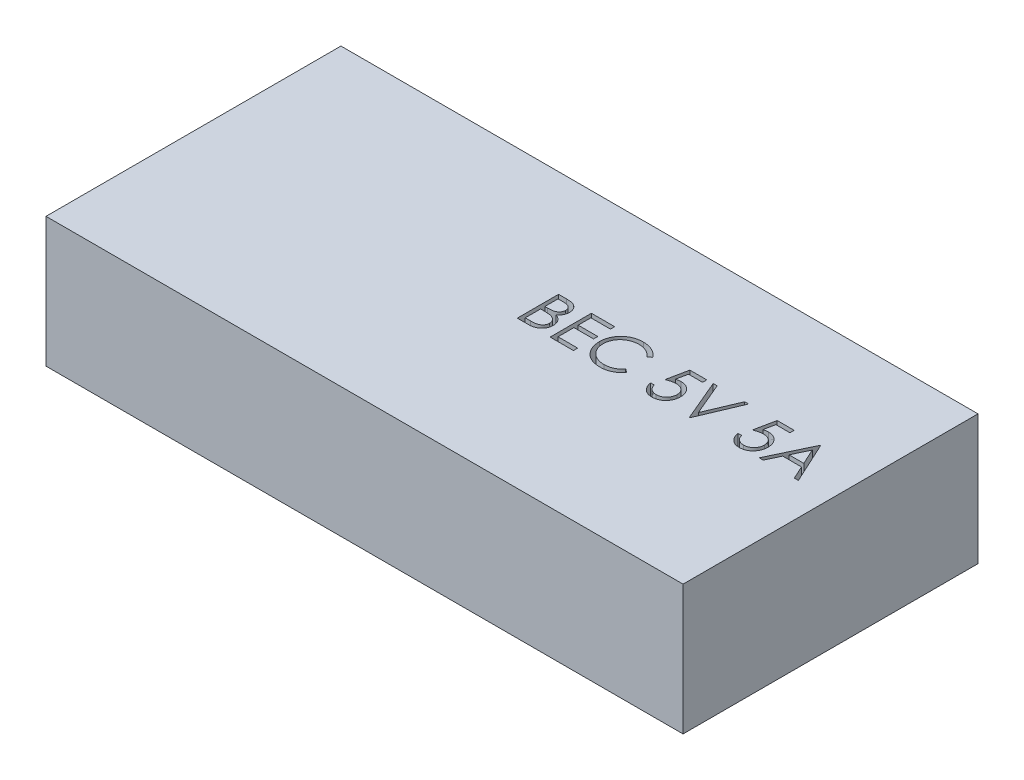
from build123d import *

# Parameters (mm, degrees)
SCHIZZO1_W                   = 54
SCHIZZO1_H                   = 25
ESTRUSIONE_ESTRUSIONE1_DEPTH = 11
TAGLIO_ESTRUSIONE1_DEPTH     = 2


with BuildPart() as part:
    # Schizzo1 → Estrusione-Estrusione1 (new body)
    with BuildSketch(Plane(origin=(0, 0, 0), x_dir=(1, 0, 0), z_dir=(0, 1, 0))):
        Rectangle(SCHIZZO1_W, SCHIZZO1_H)
    extrude(amount=ESTRUSIONE_ESTRUSIONE1_DEPTH)

    # Schizzo2 → Taglio-Estrusione1 (cut)
    # profile 1 of 7: a face of its own
    with BuildSketch(Plane(origin=(0, 11, 0), x_dir=(1, 0, 0), z_dir=(0, 1, 0))):
        with BuildLine():
            Line((0.448717949, 3.5), (1.131610577, 3.5))
            add(Edge.make_bspline(
                [(1.131610577, 3.5), (1.165039055, 3.49982425), (1.229831765, 3.499483602), (1.324051207, 3.49420047), (1.412300018, 3.486996801), (1.49460379, 3.475566708), (1.570924493, 3.461774931), (1.64149213, 3.445073115), (1.706082302, 3.425046501), (1.783195039, 3.39320022), (1.871115699, 3.345877051), (1.966314092, 3.275948486), (2.047718332, 3.190416023), (2.117904649, 3.093933368), (2.173705768, 2.987797596), (2.214075066, 2.874538407), (2.239632941, 2.755616665), (2.242261375, 2.673973487), (2.243589744, 2.63271234)],
                knots=[0, 0, 0, 0, 1.001505555, 1.941167018, 2.826882275, 3.653841531, 4.429895133, 5.150066043, 5.825578002, 6.45369114, 7.647487171, 8.808567382, 9.977351308, 11.170798116, 12.373658725, 13.556498008, 14.765093433, 16, 16, 16, 16], degree=3))
            add(Edge.make_bspline(
                [(2.243589744, 2.63271234), (2.242496525, 2.594059784), (2.240348248, 2.518103867), (2.219805488, 2.407009758), (2.18764482, 2.301258539), (2.142939571, 2.201236154), (2.084837575, 2.10920254), (2.015979256, 2.024415274), (1.932902454, 1.950464217), (1.870659214, 1.909121315), (1.839042468, 1.888120994)],
                knots=[0, 0, 0, 0, 1.044552857, 2.05264487, 3.044412934, 4.028983338, 5.005914585, 5.980388656, 6.974128949, 8, 8, 8, 8], degree=3))
            add(Edge.make_bspline(
                [(1.839042468, 1.888120994), (1.878802896, 1.872855995), (1.954874443, 1.84365027), (2.059560455, 1.792014806), (2.1497553, 1.735852696), (2.226152446, 1.674520846), (2.291490101, 1.608412035), (2.348543043, 1.536556921), (2.397224417, 1.458018163), (2.438937341, 1.373614627), (2.471486097, 1.284208159), (2.495862001, 1.190637383), (2.50982945, 1.093237828), (2.511817091, 1.026952448), (2.512820513, 0.993489583)],
                knots=[0, 0, 0, 0, 1.27268992, 2.434971085, 3.483601985, 4.442670788, 5.356604649, 6.2567628, 7.179492994, 8.113709626, 9.066344395, 10.018646069, 10.999752585, 12, 12, 12, 12], degree=3))
            add(Edge.make_bspline(
                [(2.512820513, 0.993489583), (2.511843667, 0.959322711), (2.509921695, 0.892098433), (2.495741723, 0.793343299), (2.471732616, 0.698968352), (2.43866147, 0.608363169), (2.395499155, 0.521703035), (2.342971191, 0.438889771), (2.280339627, 0.36075544), (2.210276758, 0.286431817), (2.131014613, 0.21960403), (2.045498858, 0.160088323), (1.952652538, 0.111142261), (1.854000544, 0.070026239), (1.748436228, 0.038619041), (1.63643362, 0.016646467), (1.518089319, 0.00184143), (1.436879567, 0.000624225), (1.395232372, 0)],
                knots=[0, 0, 0, 0, 0.978564426, 1.925352924, 2.850884081, 3.763762016, 4.682927383, 5.618979971, 6.567305752, 7.547517671, 8.540179244, 9.531824382, 10.526200242, 11.540722885, 12.589160233, 13.674978461, 14.80764778, 16, 16, 16, 16], degree=3))
            Line((1.395232372, 0), (0.448717949, 0))
            Line((0.448717949, 0), (0.448717949, 3.5))
        make_face()
        with BuildLine():
            Line((0.762820513, 3.141025641), (0.762820513, 2.019230769))
            Line((0.762820513, 2.019230769), (0.973858173, 2.019230769))
            add(Edge.make_bspline(
                [(0.973858173, 2.019230769), (1.004706968, 2.019630692), (1.064313128, 2.020403425), (1.150633024, 2.022616942), (1.230758042, 2.028814985), (1.304549876, 2.035011248), (1.371892319, 2.045085835), (1.432636181, 2.057077958), (1.487734778, 2.069760863), (1.551274323, 2.09133035), (1.623347272, 2.123208025), (1.700180376, 2.172679861), (1.767914846, 2.231604215), (1.825112033, 2.299595176), (1.871923504, 2.374461362), (1.904437219, 2.455008243), (1.926484503, 2.539228375), (1.928476035, 2.597046627), (1.929487179, 2.626402244)],
                knots=[0, 0, 0, 0, 1.156816544, 2.235205308, 3.236616184, 4.169592532, 5.011045266, 5.787822928, 6.49130361, 7.128639758, 8.301311294, 9.436451833, 10.541879658, 11.654887649, 12.756523258, 13.837046038, 14.901820046, 16, 16, 16, 16], degree=3))
            add(Edge.make_bspline(
                [(1.929487179, 2.626402244), (1.928960999, 2.645828015), (1.927928839, 2.683933787), (1.919475537, 2.739483141), (1.905107962, 2.791726894), (1.886653669, 2.841381004), (1.86086498, 2.886892854), (1.830501517, 2.92983605), (1.793815827, 2.968748169), (1.752058514, 3.005117667), (1.704049891, 3.037362195), (1.649818599, 3.065602958), (1.588630922, 3.088343735), (1.521518067, 3.108259887), (1.44744698, 3.122248181), (1.367272427, 3.133901569), (1.280337708, 3.139834311), (1.220192605, 3.140619673), (1.189102564, 3.141025641)],
                knots=[0, 0, 0, 0, 0.91205012, 1.789085906, 2.630437955, 3.453916878, 4.269457761, 5.079663411, 5.91843418, 6.774407191, 7.675494373, 8.627863946, 9.638891023, 10.736472738, 11.911756761, 13.175263542, 14.539845004, 16, 16, 16, 16], degree=3))
            Line((1.189102564, 3.141025641), (0.762820513, 3.141025641))
        make_face(mode=Mode.SUBTRACT)
        with BuildLine():
            Line((0.762820513, 1.66025641), (0.762820513, 0.358974359))
            Line((0.762820513, 0.358974359), (1.210136218, 0.358974359))
            add(Edge.make_bspline(
                [(1.210136218, 0.358974359), (1.242155144, 0.359358106), (1.303867402, 0.360097729), (1.392968633, 0.362512283), (1.475551736, 0.368004559), (1.551239872, 0.376650409), (1.620850325, 0.386028858), (1.683548028, 0.398640139), (1.739841221, 0.413089099), (1.805115529, 0.435423272), (1.878619037, 0.470119743), (1.957829894, 0.522433969), (2.028256112, 0.584757277), (2.088061371, 0.656888191), (2.13707436, 0.735319518), (2.172729815, 0.818464868), (2.194720671, 0.904950395), (2.197382841, 0.963917108), (2.198717949, 0.993489583)],
                knots=[0, 0, 0, 0, 1.160039823, 2.235823828, 3.228722157, 4.157150951, 4.99529583, 5.772374946, 6.472645482, 7.099169577, 8.269452708, 9.405989375, 10.527446681, 11.663510218, 12.788923519, 13.866172445, 14.929861265, 16, 16, 16, 16], degree=3))
            add(Edge.make_bspline(
                [(2.198717949, 0.993489583), (2.198441844, 1.011982924), (2.197894089, 1.048671306), (2.189633474, 1.102587125), (2.177619605, 1.154812998), (2.162088171, 1.205490739), (2.139468704, 1.253704115), (2.113062159, 1.300406674), (2.082100757, 1.345660154), (2.033856591, 1.402872407), (1.963684607, 1.46878942), (1.863977831, 1.533326923), (1.750605533, 1.58537473), (1.66837804, 1.607474206), (1.625901442, 1.618890224)],
                knots=[0, 0, 0, 0, 0.723448775, 1.435228256, 2.130040452, 2.821711965, 3.505591119, 4.210454504, 4.921174351, 5.648778258, 7.137944449, 8.670945889, 10.280296675, 12, 12, 12, 12], degree=3))
            add(Edge.make_bspline(
                [(1.625901442, 1.618890224), (1.608872346, 1.622345308), (1.571949754, 1.629836643), (1.511742174, 1.637744346), (1.443006305, 1.644789406), (1.365583428, 1.650000564), (1.279375586, 1.655387107), (1.184198668, 1.657481929), (1.080441353, 1.659981189), (1.008448981, 1.660162323), (0.971053686, 1.66025641)],
                knots=[0, 0, 0, 0, 0.634451884, 1.375622551, 2.216452059, 3.157844607, 4.20941857, 5.370758133, 6.634282058, 8, 8, 8, 8], degree=3))
            Line((0.971053686, 1.66025641), (0.762820513, 1.66025641))
        make_face(mode=Mode.SUBTRACT)
    # profile 2 of 7: a face of its own
    with BuildSketch(Plane(origin=(0, 11, 0), x_dir=(1, 0, 0), z_dir=(0, 1, 0))):
        Polygon((3.230769231, 3.5), (5.205128205, 3.5), (5.205128205, 3.141025641), (3.544871795, 3.141025641), (3.544871795, 2.064102564), (5.205128205, 2.064102564), (5.205128205, 1.705128205), (3.544871795, 1.705128205), (3.544871795, 0.358974359), (5.205128205, 0.358974359), (5.205128205, 0), (3.230769231, 0), align=None)
    # profile 3 of 7: a face of its own
    with BuildSketch(Plane(origin=(0, 11, 0), x_dir=(1, 0, 0), z_dir=(0, 1, 0))):
        with BuildLine():
            Line((9.064102564, 2.857772436), (8.789262821, 2.647435897))
            add(Edge.make_bspline(
                [(8.789262821, 2.647435897), (8.769656932, 2.670801867), (8.730709485, 2.717218783), (8.668050283, 2.782398327), (8.60274864, 2.843463589), (8.534829519, 2.900705469), (8.463070399, 2.952122234), (8.389209601, 3.000393337), (8.312011555, 3.043661075), (8.205259821, 3.096124061), (8.065611972, 3.150870216), (7.889817133, 3.196773448), (7.706306035, 3.225994623), (7.581108435, 3.229159465), (7.517427885, 3.230769231)],
                knots=[0, 0, 0, 0, 0.757959112, 1.505699292, 2.245454638, 2.979532153, 3.711538275, 4.438200793, 5.171680507, 5.909471876, 7.393775596, 8.890124382, 10.418191784, 12, 12, 12, 12], degree=3))
            add(Edge.make_bspline(
                [(7.517427885, 3.230769231), (7.482344585, 3.230365268), (7.412503593, 3.229561092), (7.308855119, 3.218951967), (7.207142068, 3.204040757), (7.107430602, 3.181915434), (7.009847643, 3.153942815), (6.913755241, 3.120517401), (6.820544641, 3.079162561), (6.728926403, 3.033454301), (6.641147192, 2.981826856), (6.558092144, 2.925513504), (6.480064177, 2.865144408), (6.407001564, 2.800493302), (6.338829616, 2.731851341), (6.276042305, 2.658487), (6.218856895, 2.580634826), (6.16613987, 2.499321419), (6.118927137, 2.414783627), (6.079397257, 2.326708556), (6.044392135, 2.236604453), (6.016692892, 2.143453293), (5.994768376, 2.047910527), (5.979640712, 1.949719739), (5.969152241, 1.849086059), (5.968352064, 1.780876747), (5.967948718, 1.746494391)],
                knots=[0, 0, 0, 0, 1.054917814, 2.100044995, 3.131103042, 4.146048494, 5.169673617, 6.183595914, 7.203665975, 8.234915748, 9.262203917, 10.264457458, 11.251630812, 12.227803204, 13.197192746, 14.159520551, 15.12972552, 16.100847026, 17.073214652, 18.039054194, 19.002613845, 19.979014051, 20.95965708, 21.949030935, 22.966165397, 24, 24, 24, 24], degree=3))
            add(Edge.make_bspline(
                [(5.967948718, 1.746494391), (5.969210537, 1.694763071), (5.971687951, 1.593195486), (5.993736285, 1.444424876), (6.027241377, 1.301904202), (6.077456954, 1.16652436), (6.139376004, 1.036616002), (6.217616616, 0.914377148), (6.308233153, 0.797960584), (6.412507572, 0.690117636), (6.526913388, 0.591603911), (6.6496613, 0.504853329), (6.780445588, 0.432538447), (6.917822218, 0.3723625), (7.062848332, 0.326105772), (7.215263134, 0.293541649), (7.37473513, 0.272299468), (7.483704529, 0.27026578), (7.53916266, 0.269230769)],
                knots=[0, 0, 0, 0, 1.029171465, 2.020641659, 2.987623507, 3.938342917, 4.889210282, 5.84687017, 6.821220943, 7.821438502, 8.827599549, 9.822697543, 10.807740252, 11.797342354, 12.80366471, 13.83203677, 14.896651826, 16, 16, 16, 16], degree=3))
            add(Edge.make_bspline(
                [(7.53916266, 0.269230769), (7.600265349, 0.270919549), (7.720530058, 0.274243472), (7.896898085, 0.302402721), (8.06573385, 0.348060638), (8.227046437, 0.411958561), (8.380381083, 0.495023849), (8.525977743, 0.595721726), (8.663959314, 0.715010059), (8.746930596, 0.806093187), (8.789262821, 0.852564103)],
                knots=[0, 0, 0, 0, 1.028121516, 2.023589091, 2.998037872, 3.967518031, 4.937445131, 5.927275754, 6.942489185, 8, 8, 8, 8], degree=3))
            Line((8.789262821, 0.852564103), (9.064102564, 0.644330929))
            add(Edge.make_bspline(
                [(9.064102564, 0.644330929), (9.041984454, 0.615792478), (8.997854179, 0.558852271), (8.926396162, 0.478580562), (8.851118865, 0.403076526), (8.771463155, 0.332948905), (8.688345363, 0.266794439), (8.600273051, 0.206492608), (8.508404018, 0.151201724), (8.413049539, 0.100574799), (8.314310926, 0.055657552), (8.212306491, 0.017203784), (8.107475916, -0.015921105), (7.999814408, -0.043173042), (7.889098651, -0.064444126), (7.775728177, -0.078663801), (7.659458301, -0.088405715), (7.58101688, -0.089293631), (7.541266026, -0.08974359)],
                knots=[0, 0, 0, 0, 0.986787822, 1.968848986, 2.935600012, 3.899624008, 4.868462664, 5.837806735, 6.815139263, 7.798259679, 8.787526145, 9.778297419, 10.776456485, 11.791383307, 12.812564526, 13.85620153, 14.913611965, 16, 16, 16, 16], degree=3))
            add(Edge.make_bspline(
                [(7.541266026, -0.08974359), (7.503622359, -0.089481597), (7.429186668, -0.088963539), (7.319287917, -0.080571372), (7.212298336, -0.069121635), (7.10852371, -0.051881504), (7.007397735, -0.031537164), (6.909837151, -0.004265907), (6.81488194, 0.026283259), (6.7229136, 0.062188246), (6.6338539, 0.102704429), (6.547990088, 0.148495987), (6.465361656, 0.199177852), (6.385156235, 0.253632863), (6.308558652, 0.313610164), (6.234905126, 0.378276799), (6.16378265, 0.44741481), (6.119779965, 0.497269663), (6.09765625, 0.522335737)],
                knots=[0, 0, 0, 0, 1.114604814, 2.203992996, 3.262667896, 4.300477797, 5.318619304, 6.316056647, 7.298880507, 8.271930387, 9.238335007, 10.195173496, 11.151986948, 12.108099108, 13.064862484, 14.031167946, 15.010108607, 16, 16, 16, 16], degree=3))
            add(Edge.make_bspline(
                [(6.09765625, 0.522335737), (6.062220607, 0.565876926), (5.99177713, 0.652433637), (5.901651446, 0.792719618), (5.824503891, 0.939187827), (5.76212797, 1.092607755), (5.713365237, 1.252635143), (5.679584042, 1.419350657), (5.657632437, 1.592598599), (5.655122149, 1.710435388), (5.653846154, 1.770332532)],
                knots=[0, 0, 0, 0, 0.994628077, 1.977248131, 2.950237994, 3.925870899, 4.908910175, 5.911660606, 6.938484602, 8, 8, 8, 8], degree=3))
            add(Edge.make_bspline(
                [(5.653846154, 1.770332532), (5.655401347, 1.833287986), (5.658461094, 1.95714891), (5.684456889, 2.138922863), (5.726275685, 2.313074262), (5.785672574, 2.479278007), (5.860977925, 2.638408287), (5.954004539, 2.789249492), (6.063671681, 2.932766292), (6.189119249, 3.066781043), (6.326686584, 3.189320396), (6.474005398, 3.297126599), (6.630787345, 3.386844115), (6.795305197, 3.461840278), (6.968790878, 3.519484741), (7.150874247, 3.559837928), (7.341213162, 3.584955044), (7.471075588, 3.588130252), (7.537059295, 3.58974359)],
                knots=[0, 0, 0, 0, 1.032925535, 2.032216505, 3.007276963, 3.968222605, 4.92396291, 5.891752235, 6.871517503, 7.883894988, 8.900124299, 9.891468569, 10.874487609, 11.85992873, 12.854644235, 13.869047385, 14.917252991, 16, 16, 16, 16], degree=3))
            add(Edge.make_bspline(
                [(7.537059295, 3.58974359), (7.577273767, 3.589261452), (7.656874264, 3.588307108), (7.774626917, 3.579000965), (7.889269243, 3.563487359), (8.000880226, 3.542371289), (8.110002842, 3.516163968), (8.215803083, 3.48202367), (8.318901769, 3.442987138), (8.418648678, 3.398028672), (8.514565228, 3.347561931), (8.606621546, 3.292146307), (8.694086405, 3.231850502), (8.777575253, 3.167187326), (8.855691464, 3.096788767), (8.930652943, 3.022591171), (8.999914021, 2.942457347), (9.042667216, 2.886052413), (9.064102564, 2.857772436)],
                knots=[0, 0, 0, 0, 1.096760587, 2.17092713, 3.219439832, 4.250915756, 5.268269357, 6.278326846, 7.281116186, 8.274029601, 9.260640565, 10.235837813, 11.203064059, 12.156899882, 13.114053108, 14.069676657, 15.032185724, 16, 16, 16, 16], degree=3))
        make_face()
    # profile 4 of 7: a face of its own
    with BuildSketch(Plane(origin=(0, 11, 0), x_dir=(1, 0, 0), z_dir=(0, 1, 0))):
        with BuildLine():
            Line((13.012820513, 3.5), (13.012820513, 3.141025641))
            Line((13.012820513, 3.141025641), (11.822315705, 3.141025641))
            Line((11.822315705, 3.141025641), (11.633713942, 2.220452724))
            add(Edge.make_bspline(
                [(11.633713942, 2.220452724), (11.670769817, 2.230682996), (11.742559713, 2.25050253), (11.848519573, 2.2725083), (11.949111777, 2.285773744), (12.014387147, 2.287585055), (12.045973558, 2.288461538)],
                knots=[0, 0, 0, 0, 1.100273476, 2.13160584, 3.095893838, 4, 4, 4, 4], degree=3))
            add(Edge.make_bspline(
                [(12.045973558, 2.288461538), (12.085057297, 2.287615603), (12.161905695, 2.285952282), (12.274344642, 2.269980432), (12.381677535, 2.244840518), (12.483679905, 2.209719996), (12.580540456, 2.164810263), (12.671368017, 2.108710322), (12.75752593, 2.043176991), (12.837468524, 1.967831979), (12.909992832, 1.884910363), (12.973758822, 1.795752492), (13.027921412, 1.701224829), (13.071482167, 1.600424221), (13.106266501, 1.494465067), (13.129418496, 1.382232485), (13.144835205, 1.264784365), (13.146557592, 1.184479795), (13.147435897, 1.143529647)],
                knots=[0, 0, 0, 0, 1.052922333, 2.070308379, 3.05430497, 4.020497103, 4.973039431, 5.925935799, 6.892292201, 7.88610001, 8.88166317, 9.857072816, 10.836096531, 11.812156883, 12.81219415, 13.836441305, 14.89672472, 16, 16, 16, 16], degree=3))
            add(Edge.make_bspline(
                [(13.147435897, 1.143529647), (13.146770822, 1.115007427), (13.14544966, 1.05834844), (13.138731072, 0.974204239), (13.125795356, 0.891841406), (13.108427632, 0.811249014), (13.085885214, 0.732579642), (13.05859616, 0.655608114), (13.025200132, 0.580813507), (12.988568757, 0.507488112), (12.947322279, 0.437289605), (12.901543772, 0.371640618), (12.85317828, 0.309556337), (12.801136895, 0.251702604), (12.7449359, 0.198459586), (12.685255933, 0.149511304), (12.622573214, 0.104029974), (12.555917972, 0.063861779), (12.486775489, 0.026898823), (12.414147272, -0.003424715), (12.339686571, -0.030535243), (12.262321696, -0.05214477), (12.182227883, -0.069077325), (12.099273107, -0.080577925), (12.013892437, -0.088954363), (11.956017425, -0.08947872), (11.926782853, -0.08974359)],
                knots=[0, 0, 0, 0, 1.056347294, 2.098418968, 3.122841568, 4.141288669, 5.149314143, 6.15115421, 7.162517403, 8.180376062, 9.185164535, 10.17417709, 11.141909838, 12.097768115, 13.052685741, 14.0056014, 14.954263652, 15.917497458, 16.885230207, 17.854509472, 18.828990115, 19.81800267, 20.826176721, 21.857883937, 22.917946725, 24, 24, 24, 24], degree=3))
            add(Edge.make_bspline(
                [(11.926782853, -0.08974359), (11.891908672, -0.089052752), (11.823297841, -0.08769361), (11.722777274, -0.073475124), (11.626062668, -0.053111208), (11.533932567, -0.022474938), (11.445561304, 0.015912357), (11.362138586, 0.064428528), (11.28153281, 0.119407632), (11.207020773, 0.184287985), (11.137864659, 0.255203667), (11.075958151, 0.332161308), (11.020824574, 0.41389075), (10.973346827, 0.500788904), (10.932848806, 0.592627435), (10.901033817, 0.689750436), (10.875355462, 0.79165044), (10.864492042, 0.86180395), (10.858974359, 0.897435897)],
                knots=[0, 0, 0, 0, 1.0467383, 2.05933395, 3.04377827, 4.011590433, 4.970194871, 5.932262533, 6.905835911, 7.896367577, 8.894135286, 9.877477877, 10.858688626, 11.851381753, 12.8477658, 13.868841284, 14.917554742, 16, 16, 16, 16], degree=3))
            Line((10.858974359, 0.897435897), (11.173076923, 0.897435897))
            add(Edge.make_bspline(
                [(11.173076923, 0.897435897), (11.18080548, 0.864059445), (11.195660197, 0.79990805), (11.228265946, 0.709776709), (11.268131821, 0.629457485), (11.31553617, 0.557887902), (11.3720862, 0.495478905), (11.436615629, 0.439861843), (11.508963352, 0.389686713), (11.589356582, 0.347863946), (11.674169661, 0.312195193), (11.762936871, 0.288443498), (11.853241217, 0.271742605), (11.914319588, 0.270070844), (11.945012019, 0.269230769)],
                knots=[0, 0, 0, 0, 1.136247022, 2.183929868, 3.172523383, 4.106158343, 5.02341133, 5.958108904, 6.928429099, 7.938127109, 8.96079061, 9.975095812, 10.982467395, 12, 12, 12, 12], degree=3))
            add(Edge.make_bspline(
                [(11.945012019, 0.269230769), (11.974970464, 0.270051547), (12.033958886, 0.271667666), (12.120770273, 0.284106678), (12.204583147, 0.303264249), (12.284570503, 0.331934104), (12.362132043, 0.366778822), (12.435305814, 0.411493898), (12.506208691, 0.462953917), (12.572636824, 0.521910547), (12.633476273, 0.586880241), (12.687232395, 0.656357635), (12.732009308, 0.730474481), (12.769743417, 0.807947634), (12.798396716, 0.889626191), (12.818837697, 0.975127366), (12.830840756, 1.064662347), (12.832491936, 1.125731656), (12.833333333, 1.156850962)],
                knots=[0, 0, 0, 0, 1.027316725, 2.022795036, 3.002884548, 3.971462791, 4.93288096, 5.914575861, 6.907176829, 7.935150275, 8.956128384, 9.956726525, 10.942570165, 11.921478529, 12.907843606, 13.90538589, 14.932640048, 16, 16, 16, 16], degree=3))
            add(Edge.make_bspline(
                [(12.833333333, 1.156850962), (12.832674854, 1.184926713), (12.831385974, 1.239881002), (12.820855404, 1.320280209), (12.802538431, 1.396353251), (12.777114551, 1.468467485), (12.744835044, 1.536690927), (12.705388731, 1.601093987), (12.658035333, 1.660827821), (12.603943445, 1.715920374), (12.544685404, 1.766765249), (12.479241661, 1.810109336), (12.408981734, 1.846573253), (12.334752135, 1.878041252), (12.254787236, 1.900641997), (12.170670604, 1.917609882), (12.081493896, 1.927425245), (12.020523208, 1.928787134), (11.989182692, 1.929487179)],
                knots=[0, 0, 0, 0, 1.045622112, 2.046656509, 3.013763289, 3.955457236, 4.890082067, 5.820317437, 6.762574623, 7.722996705, 8.69280354, 9.665887285, 10.63943826, 11.638615906, 12.663482002, 13.728887084, 14.832589034, 16, 16, 16, 16], degree=3))
            add(Edge.make_bspline(
                [(11.989182692, 1.929487179), (11.962053764, 1.928906588), (11.906039408, 1.927707815), (11.820116581, 1.918881318), (11.729824858, 1.904642024), (11.635510363, 1.885055776), (11.536889855, 1.859424699), (11.434171454, 1.828710199), (11.327139187, 1.7919882), (11.255021463, 1.764255986), (11.217948718, 1.75)],
                knots=[0, 0, 0, 0, 0.817624296, 1.688186739, 2.600797293, 3.572016777, 4.590301741, 5.671205678, 6.80286297, 8, 8, 8, 8], degree=3))
            Line((11.217948718, 1.75), (11.576923077, 3.5))
            Line((11.576923077, 3.5), (13.012820513, 3.5))
        make_face()
    # profile 5 of 7: a face of its own
    with BuildSketch(Plane(origin=(0, 11, 0), x_dir=(1, 0, 0), z_dir=(0, 1, 0))):
        Polygon((13.551282051, 3.5), (13.887820513, 3.5), (15.054487179, 0.741786859), (16.221153846, 3.5), (16.557692308, 3.5), (15.076923077, 0), (15.032051282, 0), align=None)
    # profile 6 of 7: a face of its own
    with BuildSketch(Plane(origin=(0, 11, 0), x_dir=(1, 0, 0), z_dir=(0, 1, 0))):
        with BuildLine():
            Line((20.416666667, 3.5), (20.416666667, 3.141025641))
            Line((20.416666667, 3.141025641), (19.226161859, 3.141025641))
            Line((19.226161859, 3.141025641), (19.037560096, 2.220452724))
            add(Edge.make_bspline(
                [(19.037560096, 2.220452724), (19.074615971, 2.230682996), (19.146405866, 2.25050253), (19.252365727, 2.2725083), (19.352957931, 2.285773744), (19.418233301, 2.287585055), (19.449819712, 2.288461538)],
                knots=[0, 0, 0, 0, 1.100273476, 2.13160584, 3.095893838, 4, 4, 4, 4], degree=3))
            add(Edge.make_bspline(
                [(19.449819712, 2.288461538), (19.488903451, 2.287615603), (19.565751849, 2.285952282), (19.678190796, 2.269980432), (19.785523689, 2.244840518), (19.887526059, 2.209719996), (19.98438661, 2.164810263), (20.075214171, 2.108710322), (20.161372084, 2.043176991), (20.241314678, 1.967831979), (20.313838986, 1.884910363), (20.377604976, 1.795752492), (20.431767566, 1.701224829), (20.475328321, 1.600424221), (20.510112655, 1.494465067), (20.53326465, 1.382232485), (20.548681359, 1.264784365), (20.550403745, 1.184479795), (20.551282051, 1.143529647)],
                knots=[0, 0, 0, 0, 1.052922333, 2.070308379, 3.05430497, 4.020497103, 4.973039431, 5.925935799, 6.892292201, 7.88610001, 8.88166317, 9.857072816, 10.836096531, 11.812156883, 12.81219415, 13.836441305, 14.89672472, 16, 16, 16, 16], degree=3))
            add(Edge.make_bspline(
                [(20.551282051, 1.143529647), (20.550616976, 1.115007427), (20.549295813, 1.05834844), (20.542577226, 0.974204239), (20.52964151, 0.891841406), (20.512273786, 0.811249014), (20.489731368, 0.732579642), (20.462442314, 0.655608114), (20.429046286, 0.580813507), (20.392414911, 0.507488112), (20.351168433, 0.437289605), (20.305389926, 0.371640618), (20.257024434, 0.309556337), (20.204983049, 0.251702604), (20.148782054, 0.198459586), (20.089102087, 0.149511304), (20.026419368, 0.104029974), (19.959764126, 0.063861779), (19.890621643, 0.026898823), (19.817993425, -0.003424715), (19.743532725, -0.030535243), (19.666167849, -0.05214477), (19.586074037, -0.069077325), (19.503119261, -0.080577925), (19.417738591, -0.088954363), (19.359863579, -0.08947872), (19.330629006, -0.08974359)],
                knots=[0, 0, 0, 0, 1.056347294, 2.098418968, 3.122841568, 4.141288669, 5.149314143, 6.15115421, 7.162517403, 8.180376062, 9.185164535, 10.17417709, 11.141909838, 12.097768115, 13.052685741, 14.0056014, 14.954263652, 15.917497458, 16.885230207, 17.854509472, 18.828990115, 19.81800267, 20.826176721, 21.857883937, 22.917946725, 24, 24, 24, 24], degree=3))
            add(Edge.make_bspline(
                [(19.330629006, -0.08974359), (19.295754826, -0.089052752), (19.227143995, -0.08769361), (19.126623428, -0.073475124), (19.029908822, -0.053111208), (18.937778721, -0.022474938), (18.849407457, 0.015912357), (18.76598474, 0.064428528), (18.685378964, 0.119407632), (18.610866927, 0.184287985), (18.541710813, 0.255203667), (18.479804304, 0.332161308), (18.424670728, 0.41389075), (18.377192981, 0.500788904), (18.336694959, 0.592627435), (18.304879971, 0.689750436), (18.279201616, 0.79165044), (18.268338196, 0.86180395), (18.262820513, 0.897435897)],
                knots=[0, 0, 0, 0, 1.0467383, 2.05933395, 3.04377827, 4.011590433, 4.970194871, 5.932262533, 6.905835911, 7.896367577, 8.894135286, 9.877477877, 10.858688626, 11.851381753, 12.8477658, 13.868841284, 14.917554742, 16, 16, 16, 16], degree=3))
            Line((18.262820513, 0.897435897), (18.576923077, 0.897435897))
            add(Edge.make_bspline(
                [(18.576923077, 0.897435897), (18.584651634, 0.864059445), (18.599506351, 0.79990805), (18.6321121, 0.709776709), (18.671977975, 0.629457485), (18.719382323, 0.557887902), (18.775932354, 0.495478905), (18.840461783, 0.439861843), (18.912809506, 0.389686713), (18.993202736, 0.347863946), (19.078015815, 0.312195193), (19.166783025, 0.288443498), (19.257087371, 0.271742605), (19.318165742, 0.270070844), (19.348858173, 0.269230769)],
                knots=[0, 0, 0, 0, 1.136247022, 2.183929868, 3.172523383, 4.106158343, 5.02341133, 5.958108904, 6.928429099, 7.938127109, 8.96079061, 9.975095812, 10.982467395, 12, 12, 12, 12], degree=3))
            add(Edge.make_bspline(
                [(19.348858173, 0.269230769), (19.378816617, 0.270051547), (19.43780504, 0.271667666), (19.524616426, 0.284106678), (19.608429301, 0.303264249), (19.688416657, 0.331934104), (19.765978197, 0.366778822), (19.839151967, 0.411493898), (19.910054844, 0.462953917), (19.976482978, 0.521910547), (20.037322427, 0.586880241), (20.091078548, 0.656357635), (20.135855462, 0.730474481), (20.173589571, 0.807947634), (20.20224287, 0.889626191), (20.222683851, 0.975127366), (20.23468691, 1.064662347), (20.23633809, 1.125731656), (20.237179487, 1.156850962)],
                knots=[0, 0, 0, 0, 1.027316725, 2.022795036, 3.002884548, 3.971462791, 4.93288096, 5.914575861, 6.907176829, 7.935150275, 8.956128384, 9.956726525, 10.942570165, 11.921478529, 12.907843606, 13.90538589, 14.932640048, 16, 16, 16, 16], degree=3))
            add(Edge.make_bspline(
                [(20.237179487, 1.156850962), (20.236521008, 1.184926713), (20.235232128, 1.239881002), (20.224701558, 1.320280209), (20.206384585, 1.396353251), (20.180960705, 1.468467485), (20.148681198, 1.536690927), (20.109234885, 1.601093987), (20.061881487, 1.660827821), (20.007789599, 1.715920374), (19.948531558, 1.766765249), (19.883087815, 1.810109336), (19.812827888, 1.846573253), (19.738598289, 1.878041252), (19.65863339, 1.900641997), (19.574516758, 1.917609882), (19.48534005, 1.927425245), (19.424369362, 1.928787134), (19.393028846, 1.929487179)],
                knots=[0, 0, 0, 0, 1.045622112, 2.046656509, 3.013763289, 3.955457236, 4.890082067, 5.820317437, 6.762574623, 7.722996705, 8.69280354, 9.665887285, 10.63943826, 11.638615906, 12.663482002, 13.728887084, 14.832589034, 16, 16, 16, 16], degree=3))
            add(Edge.make_bspline(
                [(19.393028846, 1.929487179), (19.365899917, 1.928906588), (19.309885562, 1.927707815), (19.223962735, 1.918881318), (19.133671012, 1.904642024), (19.039356517, 1.885055776), (18.940736009, 1.859424699), (18.838017608, 1.828710199), (18.730985341, 1.7919882), (18.658867617, 1.764255986), (18.621794872, 1.75)],
                knots=[0, 0, 0, 0, 0.817624296, 1.688186739, 2.600797293, 3.572016777, 4.590301741, 5.671205678, 6.80286297, 8, 8, 8, 8], degree=3))
            Line((18.621794872, 1.75), (18.980769231, 3.5))
            Line((18.980769231, 3.5), (20.416666667, 3.5))
        make_face()
    # profile 7 of 7: a face of its own
    with BuildSketch(Plane(origin=(0, 11, 0), x_dir=(1, 0, 0), z_dir=(0, 1, 0))):
        Polygon((22.66025641, 3.5), (24.275641026, 0), (23.934194712, 0), (23.416766827, 1.121794872), (21.830128205, 1.121794872), (21.297976763, 0), (20.955128205, 0), (22.615384615, 3.5), align=None)
        Polygon((22.634314904, 2.817808494), (22.000500801, 1.480769231), (23.251302083, 1.480769231), align=None, mode=Mode.SUBTRACT)
    extrude(amount=-TAGLIO_ESTRUSIONE1_DEPTH, mode=Mode.SUBTRACT)


solid = part.part
